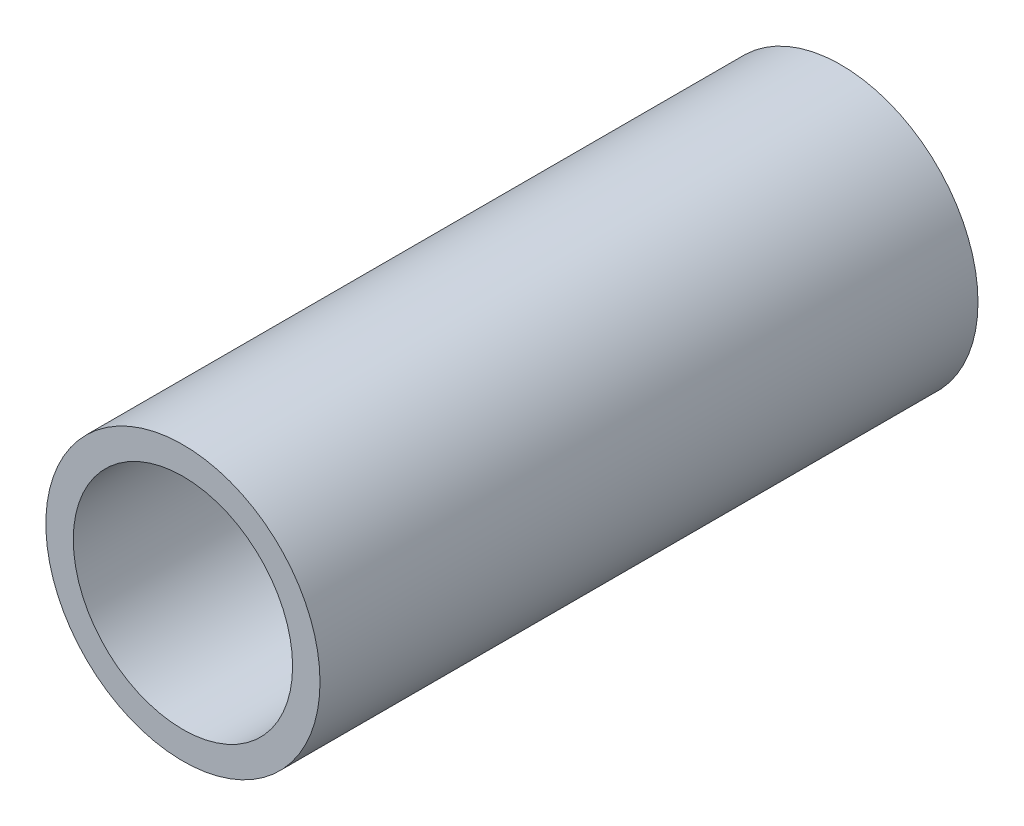
from build123d import *

# Parameters (mm, degrees)
SKICA1_R                = 5
SKICA1_R_2              = 4
P_IDAT_VYSUNUT_M1_DEPTH = 24


with BuildPart() as part:
    # Skica1 → Přidat vysunutím1 (new body)
    with BuildSketch(Plane.XY):
        Circle(SKICA1_R)
        Circle(SKICA1_R_2, mode=Mode.SUBTRACT)
    extrude(amount=P_IDAT_VYSUNUT_M1_DEPTH)


solid = part.part
